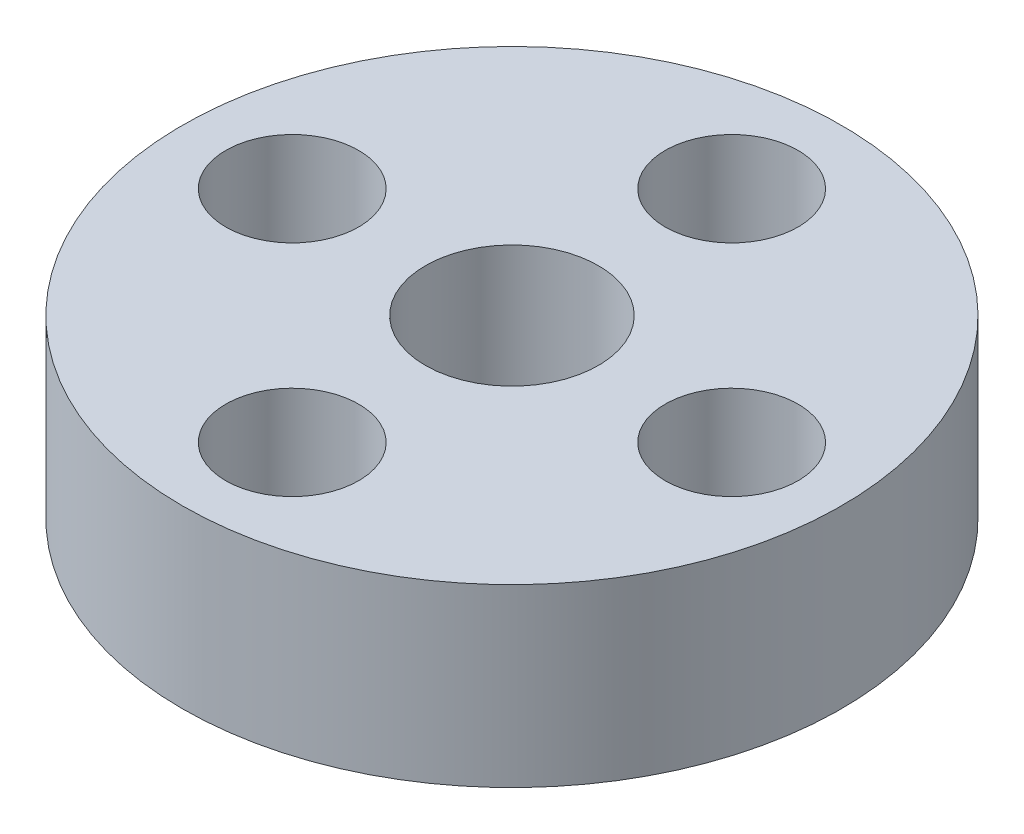
from build123d import *

# Parameters (mm, degrees)
SKETCH1_R           = 9.525
SKETCH1_R_2         = 1.92
SKETCH1_R_3         = 2.5
BOSS_EXTRUDE1_DEPTH = 5.08


with BuildPart() as part:
    # Sketch1 → Boss-Extrude1 (new body)
    with BuildSketch(Plane(origin=(0, 0, 0), x_dir=(1, 0, 0), z_dir=(0, 1, 0))):
        with Locations(Location((0, 0, 0), (0, 0, 270))):
            Circle(SKETCH1_R)
        with Locations(Location((0, 6.35, 0), (0, 0, 270))):
            Circle(SKETCH1_R_2, mode=Mode.SUBTRACT)
        with Locations(Location((6.35, 0, 0), (0, 0, 270))):
            Circle(SKETCH1_R_2, mode=Mode.SUBTRACT)
        with Locations(Location((0, -6.35, 0), (0, 0, 270))):
            Circle(SKETCH1_R_2, mode=Mode.SUBTRACT)
        with Locations(Location((-6.35, 0, 0), (0, 0, 270))):
            Circle(SKETCH1_R_2, mode=Mode.SUBTRACT)
        with Locations(Location((0, 0, 0), (0, 0, 270))):
            Circle(SKETCH1_R_3, mode=Mode.SUBTRACT)
    extrude(amount=BOSS_EXTRUDE1_DEPTH)


solid = part.part
